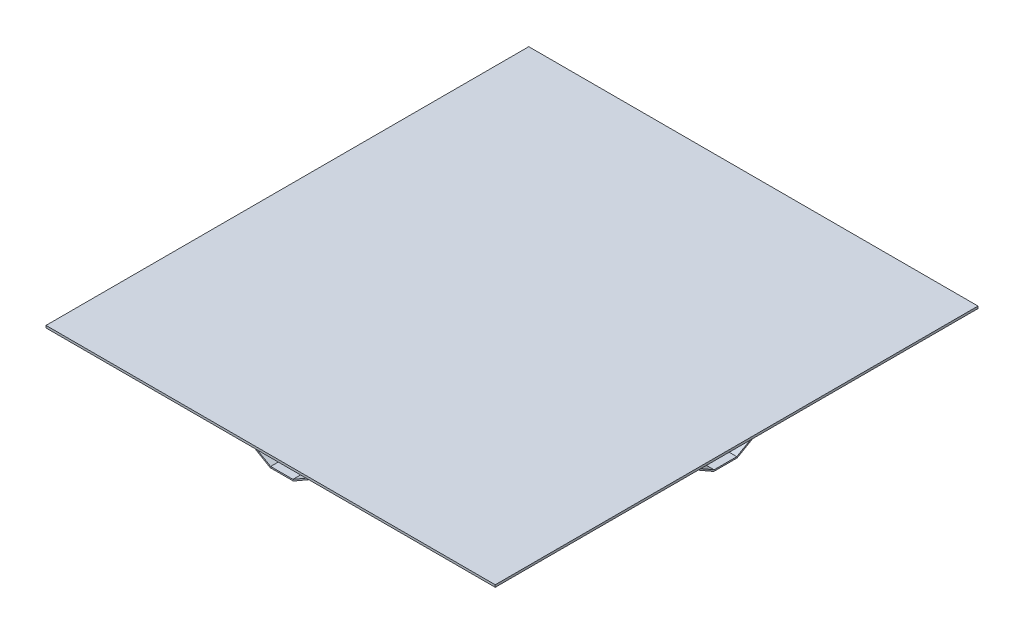
from build123d import *

# Parameters (mm, degrees)
SKETCH_1_W           = 1005
SKETCH_1_H           = 1080
EXTRUDE_1_DEPTH      = 3
EXTRUDE_2_DEPTH      = 515
EXTRUDE_2_DEPTH_BACK = 515
EXTRUDE_3_DEPTH      = 477.5
EXTRUDE_3_DEPTH_BACK = 477.5
SKETCH_5_W           = 1005
SKETCH_5_H           = 1080
SKETCH_5_W_2         = 975
SKETCH_5_H_2         = 1050
EXTRUDE_5_DEPTH      = 2


with BuildPart() as part:
    # Эскиз1 → Бобышка-Вытянуть1 (new body)
    with BuildSketch(Plane(origin=(0, 0, 0), x_dir=(1, 0, 0), z_dir=(0, 1, 0))):
        Rectangle(SKETCH_1_W, SKETCH_1_H)
    extrude(amount=EXTRUDE_1_DEPTH)

    # Эскиз2 → Бобышка-Вытянуть2 (add, two sides: drawn at the far end of the back side and taken through both)
    with BuildSketch(Plane.XY.offset(-EXTRUDE_2_DEPTH_BACK)):
        Polygon((25, -44), (-25, -44), (-101.210235533, 0), (-152.01408311, 0), (-152.01408311, -3), (-102.01408311, -3), (-25.803847577, -47), (25.803847577, -47), (102.01408311, -3), (152.01408311, -3), (152.01408311, 0), (101.210235533, 0), align=None)
    extrude(amount=EXTRUDE_2_DEPTH + EXTRUDE_2_DEPTH_BACK)

    # Эскиз3 → Бобышка-Вытянуть3 (add, two sides: drawn at the far end of the back side and taken through both)
    with BuildSketch(Plane(origin=(0, 0, 0), x_dir=(0, 0, -1), z_dir=(1, 0, 0)).offset(-EXTRUDE_3_DEPTH_BACK)):
        Polygon((-26.205771366, -47), (26.205771366, -47), (102.416006899, -3), (152.416006899, -3), (152.416006899, 0), (101.612159322, 0), (25.401923789, -44), (-25.401923789, -44), (-101.612159322, 0), (-152.416006899, 0), (-152.416006899, -3), (-102.416006899, -3), align=None)
    extrude(amount=EXTRUDE_3_DEPTH + EXTRUDE_3_DEPTH_BACK)

    # Эскиз5 → Бобышка-Вытянуть5 (add)
    with BuildSketch(Plane.XZ):
        Rectangle(SKETCH_5_W, SKETCH_5_H)
        Rectangle(SKETCH_5_W_2, SKETCH_5_H_2, mode=Mode.SUBTRACT)
    extrude(amount=EXTRUDE_5_DEPTH)


solid = part.part
